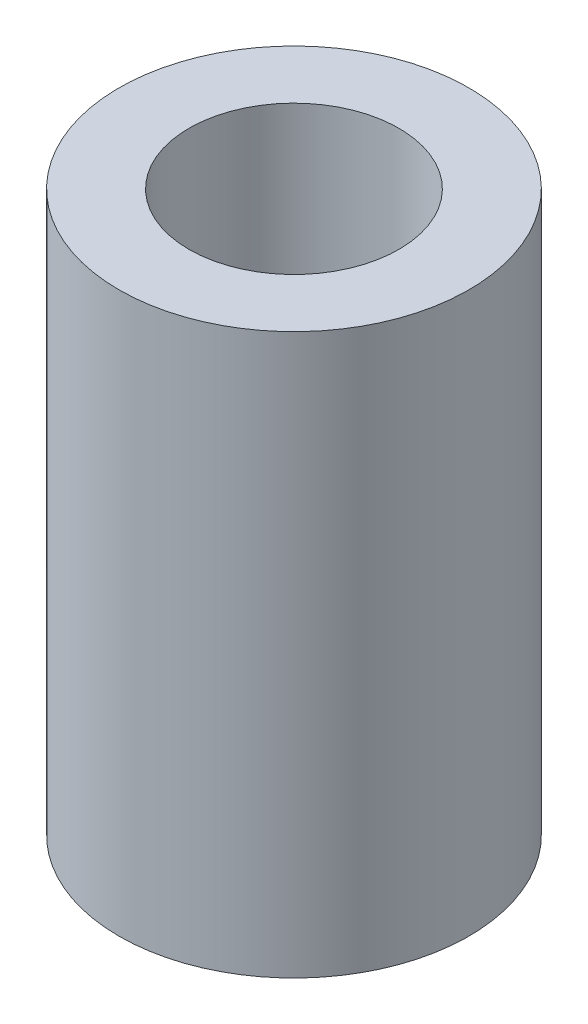
from build123d import *

# Parameters (mm, degrees)
ESQUISSE1_R        = 5
ESQUISSE1_R_2      = 3
BOSS_EXTRU_1_DEPTH = 16


with BuildPart() as part:
    # Esquisse1 → Boss.-Extru.1 (new body)
    with BuildSketch(Plane(origin=(0, 0, 0), x_dir=(1, 0, 0), z_dir=(0, 1, 0))):
        with Locations(Location((0, 0, 0), (0, 0, 270))):
            Circle(ESQUISSE1_R)
        with Locations(Location((0, 0, 0), (0, 0, 270))):
            Circle(ESQUISSE1_R_2, mode=Mode.SUBTRACT)
    extrude(amount=BOSS_EXTRU_1_DEPTH)


solid = part.part
